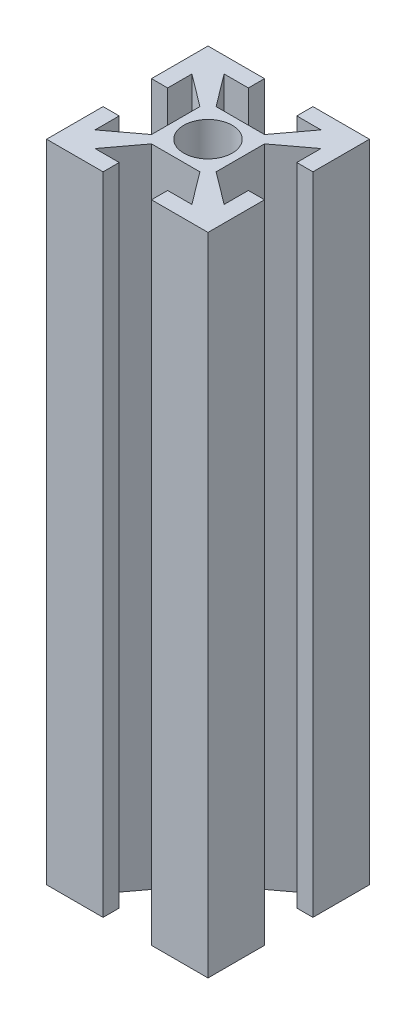
from build123d import *

# Parameters (mm, degrees)
SKETCH_1_R      = 3
EXTRUDE_1_DEPTH = 80


with BuildPart() as part:
    # 草圖1 → 填料-伸長1 (new body)
    with BuildSketch(Plane(origin=(0, 0, 0), x_dir=(1, 0, 0), z_dir=(0, 1, 0))):
        Polygon((3, 10), (10, 10), (10, 3), (8, 3), (8, 6), (4, 3), (4, -3), (8, -6), (8, -3), (10, -3), (10, -10), (3, -10), (3, -8), (6, -8), (3, -4), (-3, -4), (-6, -8), (-3, -8), (-3, -10), (-10, -10), (-10, -3), (-8, -3), (-8, -6), (-4, -3), (-4, 3), (-8, 6), (-8, 3), (-10, 3), (-10, 10), (-3, 10), (-3, 8), (-6, 8), (-3, 4), (3, 4), (6, 8), (3, 8), align=None)
        with Locations(Location((0, 0, 0), (0, 0, 270))):
            Circle(SKETCH_1_R, mode=Mode.SUBTRACT)
    extrude(amount=EXTRUDE_1_DEPTH)


solid = part.part
